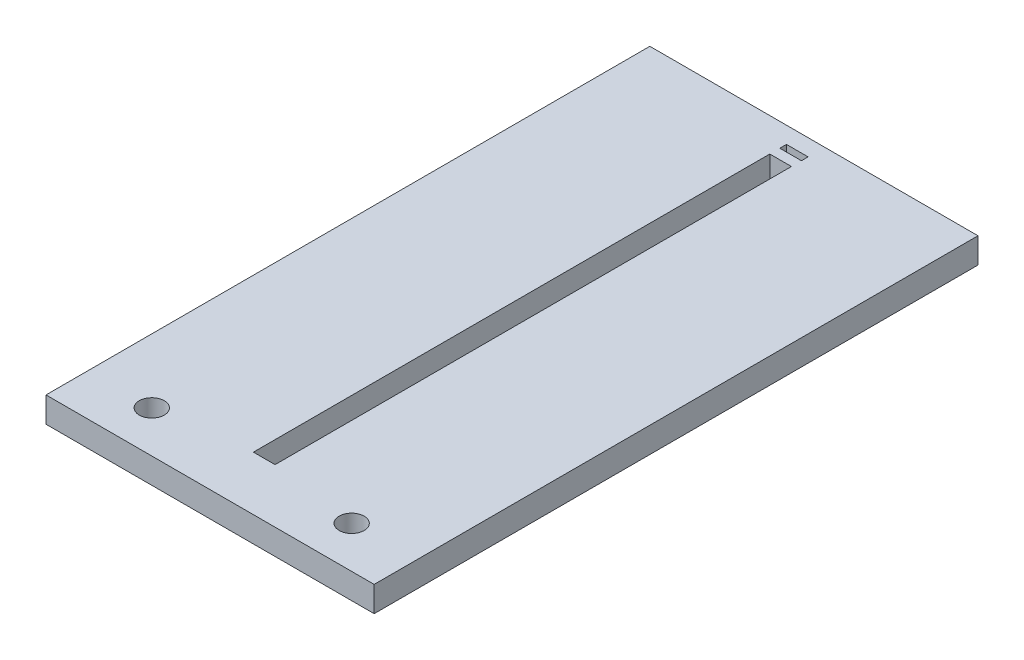
from build123d import *

# Parameters (mm, degrees)
SKETCH1_W           = 39.4
SKETCH1_H           = 72.5
BOSS_EXTRUDE1_DEPTH = 3.05
SKETCH4_W           = 1.3
SKETCH4_H           = 0.8
SKETCH4_H_2         = 62
CUT_EXTRUDE1_DEPTH  = 76.190707538
SKETCH7_R           = 1.5
CUT_EXTRUDE4_DEPTH  = 76.190707538


with BuildPart() as part:
    # Sketch1 → Boss-Extrude1 (new body)
    with BuildSketch(Plane(origin=(0, 0, 0), x_dir=(1, 0, 0), z_dir=(0, 1, 0))):
        with Locations((0, 36.25)):
            Rectangle(SKETCH1_W, SKETCH1_H)
    extrude(amount=BOSS_EXTRUDE1_DEPTH)

    # Sketch4 → Cut-Extrude1 (cut, through all)
    with BuildSketch(Plane(origin=(0, 3.05, 0), x_dir=(1, 0, 0), z_dir=(0, 1, 0))):
        with Locations((-0.65, 70.1)):
            Rectangle(SKETCH4_W, SKETCH4_H)
        with Locations((-0.65, 37.5)):
            Rectangle(SKETCH4_W, SKETCH4_H_2)
        with Locations((0.65, 37.5)):
            Rectangle(SKETCH4_W, SKETCH4_H_2)
        with Locations((0.65, 70.1)):
            Rectangle(SKETCH4_W, SKETCH4_H)
    extrude(amount=-CUT_EXTRUDE1_DEPTH, mode=Mode.SUBTRACT)

    # Sketch7 → Cut-Extrude4 (cut, through all)
    with BuildSketch(Plane(origin=(0, 3.05, 0), x_dir=(1, 0, 0), z_dir=(0, 1, 0))):
        with Locations(Location((-12, 5, 0), (0, 0, 270))):
            Circle(SKETCH7_R)
        with Locations(Location((12, 5, 0), (0, 0, 90))):
            Circle(SKETCH7_R)
    extrude(amount=-CUT_EXTRUDE4_DEPTH, mode=Mode.SUBTRACT)


solid = part.part
